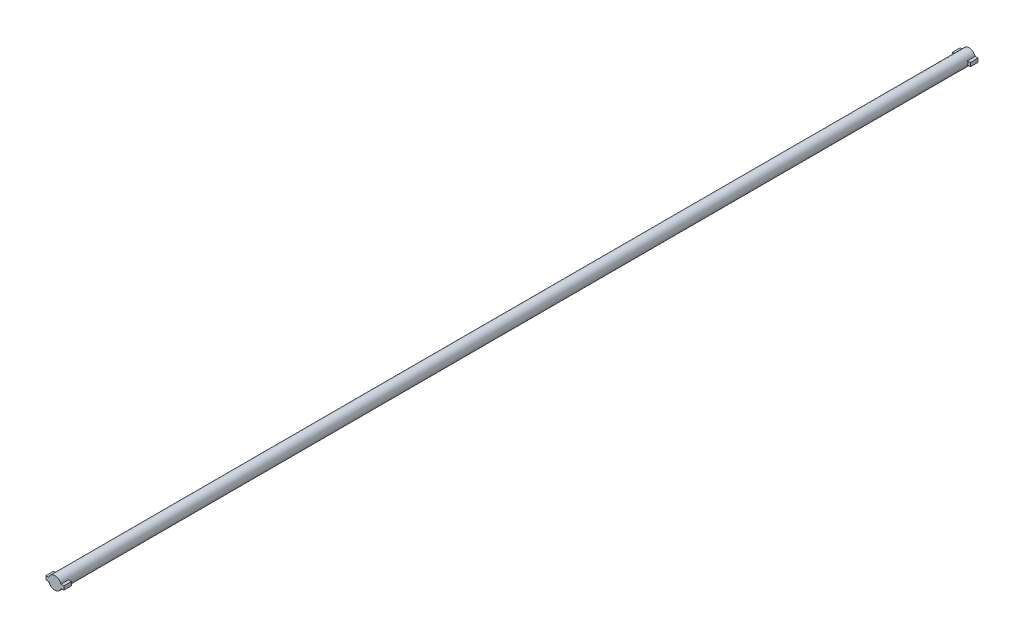
from build123d import *

# Parameters (mm, degrees)
SKETCH1_R              = 3.175
BOSS_EXTRUDE1_DEPTH    = 457.2
BOSS_EXTRUDE2_START    = -3.81
BOSS_EXTRUDE2_DEPTH    = 3.81
CIRPATTERN1_COUNT      = 2
LPATTERN1_COUNT        = 2
LPATTERN1_PITCH        = 453.39
LPATTERN1_START        = -3.81
LPATTERN1_COPY_1_DEPTH = 3.81


with BuildPart() as part:
    # Sketch1 → Boss-Extrude1 (new body)
    with BuildSketch(Plane.XY):
        Circle(SKETCH1_R)
    extrude(amount=BOSS_EXTRUDE1_DEPTH)

    # Sketch3 → Boss-Extrude2 (add)
    with BuildSketch(Plane.XY.offset(457.2).offset(BOSS_EXTRUDE2_START)):
        with BuildLine():
            Line((4.445, 0.9525), (4.445, -0.9525))
            Line((4.445, -0.9525), (3.028756964, -0.9525))
            ThreePointArc((3.028756964, -0.9525), (3.175, 0), (3.028756964, 0.9525))
            Line((3.028756964, 0.9525), (4.445, 0.9525))
        make_face()
    boss_extrude2 = extrude(amount=BOSS_EXTRUDE2_DEPTH)

    # CirPattern1: Boss-Extrude2 ×2 about axis
    cirpattern1_axis = Axis((0, 0, 0), (0, 0, 1))
    for i in range(1, CIRPATTERN1_COUNT):
        add(boss_extrude2.rotate(cirpattern1_axis, i * 360 / CIRPATTERN1_COUNT))

    # LPattern1: Boss-Extrude2 ×2
    with Locations(*[(0, 0, -i * LPATTERN1_PITCH) for i in range(1, LPATTERN1_COUNT)]):
        add(boss_extrude2)

    # LPattern1 copy 1 sketch → LPattern1 copy 1 (add)
    with BuildSketch(Plane(origin=(0, 0, 3.81), x_dir=(-1, 0, 0), z_dir=(0, 0, 1)).offset(LPATTERN1_START)):
        with BuildLine():
            Line((4.445, 0.9525), (4.445, -0.9525))
            Line((4.445, -0.9525), (3.028756964, -0.9525))
            ThreePointArc((3.028756964, -0.9525), (3.175, 0), (3.028756964, 0.9525))
            Line((3.028756964, 0.9525), (4.445, 0.9525))
        make_face()
    extrude(amount=LPATTERN1_COPY_1_DEPTH)


solid = part.part
